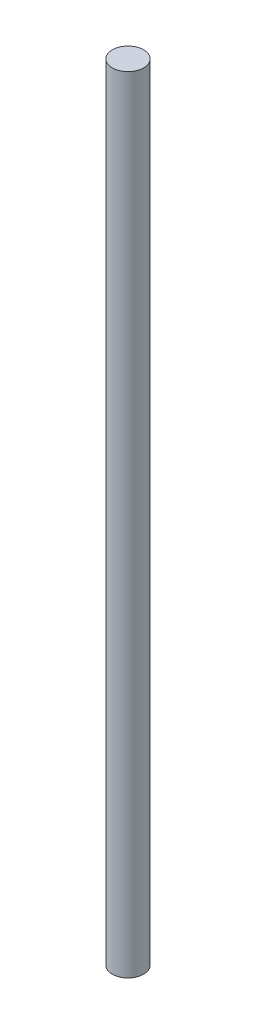
from build123d import *

# Parameters (mm, degrees)
SKETCH_1_R      = 10
EXTRUDE_1_DEPTH = 500


with BuildPart() as part:
    # 草图1 → 凸台-拉伸1 (new body)
    with BuildSketch(Plane(origin=(0, 0, 0), x_dir=(1, 0, 0), z_dir=(0, 1, 0))):
        with Locations(Location((0, 0, 0), (0, 0, 270))):
            Circle(SKETCH_1_R)
    extrude(amount=EXTRUDE_1_DEPTH)


solid = part.part
